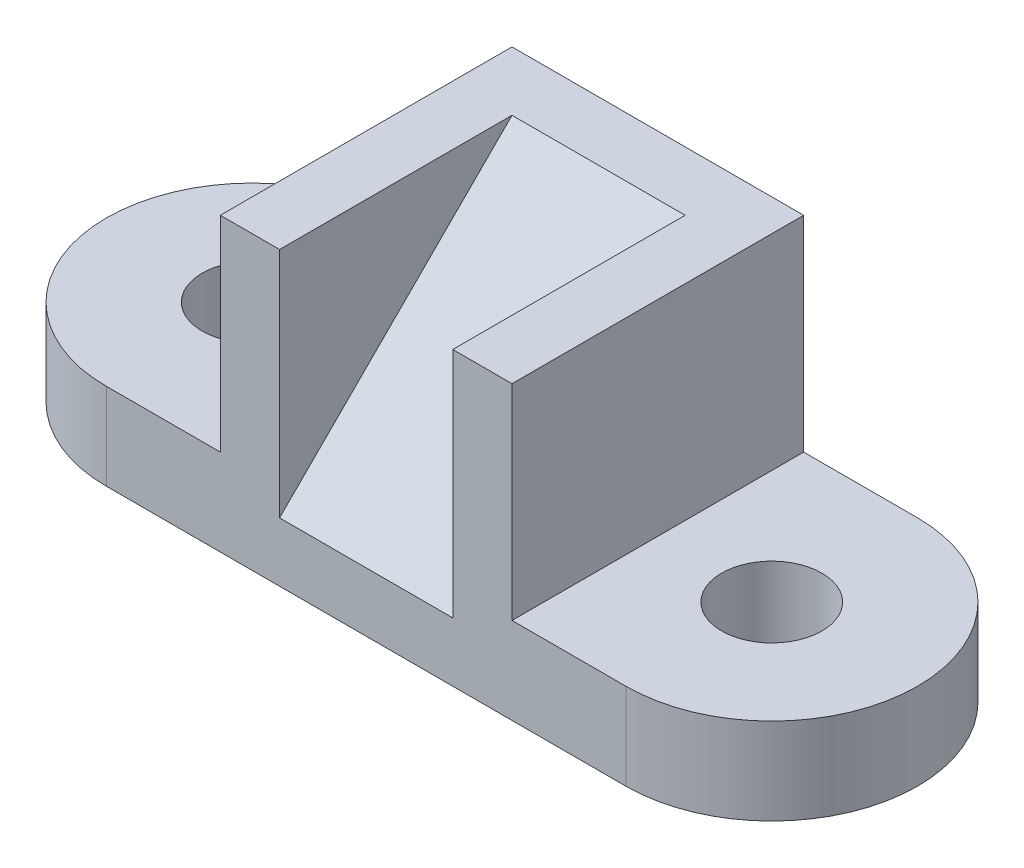
from build123d import *

# Parameters (mm, degrees)
SKETCH1_R           = 11
BOSS_EXTRUDE1_DEPTH = 13
SKETCH2_W           = 38
SKETCH2_H           = 51
BOSS_EXTRUDE2_DEPTH = 51
CUT_EXTRUDE1_DEPTH  = 130.553077926
SKETCH4_R           = 11
BOSS_EXTRUDE3_DEPTH = 6
BOSS_EXTRUDE4_DEPTH = 45


with BuildPart() as part:
    # Sketch1 → Boss-Extrude1 (new body)
    with BuildSketch(Plane(origin=(0, 0, 0), x_dir=(1, 0, 0), z_dir=(0, 1, 0))):
        with BuildLine():
            Line((-57, -32), (57, -32))
            ThreePointArc((57, -32), (89, 0), (57, 32))
            Line((57, 32), (-57, 32))
            ThreePointArc((-57, 32), (-89, 0), (-57, -32))
        make_face()
        with Locations(Location((-57, 0, 0), (0, 0, 90))):
            Circle(SKETCH1_R, mode=Mode.SUBTRACT)
        with Locations(Location((57, 0, 0), (0, 0, 90))):
            Circle(SKETCH1_R, mode=Mode.SUBTRACT)
    extrude(amount=BOSS_EXTRUDE1_DEPTH)

    # Sketch2 → Boss-Extrude2 (add)
    with BuildSketch(Plane(origin=(0, 13, 0), x_dir=(1, 0, 0), z_dir=(0, 1, 0))):
        with Locations((0, -6.5)):
            Rectangle(SKETCH2_W, SKETCH2_H)
    extrude(amount=BOSS_EXTRUDE2_DEPTH)

    # Sketch3 → Cut-Extrude1 (cut, through all)
    with BuildSketch(Plane.ZY.offset(19)):
        Polygon((32, 64), (32, 13), (-19, 64), align=None)
    extrude(amount=-CUT_EXTRUDE1_DEPTH, mode=Mode.SUBTRACT)

    # Sketch4 → Boss-Extrude3 (add)
    with BuildSketch(Plane(origin=(0, 13, 0), x_dir=(1, 0, 0), z_dir=(0, 1, 0))):
        with BuildLine():
            Line((-19, -32), (-19, 19))
            Line((-19, 19), (19, 19))
            Line((19, 19), (19, -32))
            Line((19, -32), (57, -32))
            ThreePointArc((57, -32), (89, 0), (57, 32))
            Line((57, 32), (-57, 32))
            ThreePointArc((-57, 32), (-89, 0), (-57, -32))
            Line((-57, -32), (-19, -32))
        make_face()
        with Locations(Location((-57, 0, 0), (0, 0, 90))):
            Circle(SKETCH4_R, mode=Mode.SUBTRACT)
        with Locations(Location((57, 0, 0), (0, 0, 90))):
            Circle(SKETCH4_R, mode=Mode.SUBTRACT)
    extrude(amount=BOSS_EXTRUDE3_DEPTH)

    # Sketch5 → Boss-Extrude4 (add)
    with BuildSketch(Plane(origin=(0, 19, 0), x_dir=(1, 0, 0), z_dir=(0, 1, 0))):
        Polygon((-32, -32), (-19, -32), (-19, -26), (-19, 19), (19, 19), (19, -26), (19, -32), (32, -32), (32, 32), (-32, 32), align=None)
    extrude(amount=BOSS_EXTRUDE4_DEPTH)


solid = part.part
